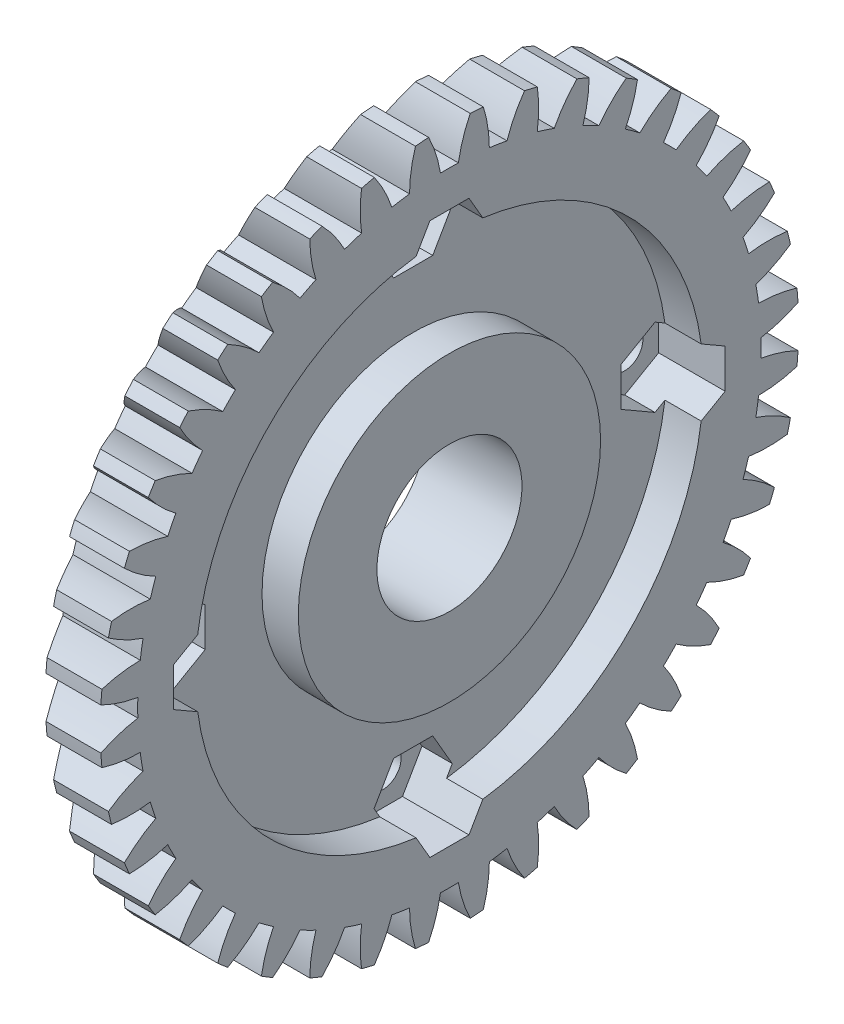
from build123d import *

# Parameters (mm, degrees)
BASPROSKE_W         = 8
BASPROSKE_H         = 28.875
TOOTHCUT_DEPTH      = 42.61167204
TEETHCUTS_COUNT     = 40
BORSKE_R            = 6
BORE_DEPTH          = 50.0000508
SKETCH_1_R          = 1.5
CUT_EXTRUDE_1_DEPTH = 42.540438945
CUT_EXTRUDE_2_DEPTH = 5.5
SKETCH_3_R          = 21
SKETCH_3_R_2        = 12.5
CUT_EXTRUDE_3_DEPTH = 3


with BuildPart() as part:
    # BasProSke → Base-Revolve (revolve)
    with BuildSketch(Plane(origin=(0, 0, 0), x_dir=(1, 0, 0), z_dir=(0, 1, 0)), mode=Mode.PRIVATE) as base_revolve_sk:
        with Locations((4, 14.4375)):
            Rectangle(BASPROSKE_W, BASPROSKE_H)
    revolve(base_revolve_sk.sketch.rotate(Axis((-10, 0, 0), (1, 0, 0)), 180), axis=Axis((-10, 0, 0), (1, 0, 0)))

    # TooCutSke → ToothCut (cut, through all)
    with BuildSketch(Plane(origin=(0, 0, 0), x_dir=(0, 0, -1), z_dir=(1, 0, 0))):
        with BuildLine():
            ThreePointArc((0.73985828, 25.769631348), (0, 25.78025), (-0.73985828, 25.769631348))
            ThreePointArc((-0.73985828, 25.769631348), (-1.12269264, 27.345722393), (-1.733123409, 28.848386496))
            ThreePointArc((-1.733123409, 28.848386496), (0, 28.9004), (1.733123409, 28.848386496))
            ThreePointArc((1.733123409, 28.848386496), (1.12269264, 27.345722393), (0.73985828, 25.769631348))
        make_face()
    toothcut = extrude(amount=TOOTHCUT_DEPTH, mode=Mode.SUBTRACT)

    # TeethCuts: ToothCut ×40 about axis
    teethcuts_axis = Axis((0, 0, 0), (1, 0, 0))
    for i in range(1, TEETHCUTS_COUNT):
        add(toothcut.rotate(teethcuts_axis, i * 360 / TEETHCUTS_COUNT), mode=Mode.SUBTRACT)

    # BorSke → Bore (cut, symmetric)
    with BuildSketch(Plane(origin=(0, 0, 0), x_dir=(0, 0, -1), z_dir=(1, 0, 0))):
        with Locations(Location((0, 0, 0), (0, 0, 180))):
            Circle(BORSKE_R)
    extrude(amount=BORE_DEPTH, both=True, mode=Mode.SUBTRACT)

    # 草图1 → 切除-拉伸1 (cut, through all)
    with BuildSketch(Plane(origin=(8, 0, 0), x_dir=(0, 0, -1), z_dir=(1, 0, 0))):
        with Locations((20, 0)):
            Circle(SKETCH_1_R)
        with Locations((0, -20)):
            Circle(SKETCH_1_R)
        with Locations((-20, 0)):
            Circle(SKETCH_1_R)
        with Locations((0, 20)):
            Circle(SKETCH_1_R)
    extrude(amount=-CUT_EXTRUDE_1_DEPTH, mode=Mode.SUBTRACT)

    # 草图2 → 切除-拉伸2 (cut)
    with BuildSketch(Plane(origin=(8, 0, 0), x_dir=(0, 0, -1), z_dir=(1, 0, 0))):
        Polygon((-1.616580754, 17.2), (1.616580754, 17.2), (3.233161507, 20), (1.616580754, 22.8), (-1.616580754, 22.8), (-3.233161507, 20), align=None)
        Polygon((17.2, 1.616580754), (17.2, -1.616580754), (20, -3.233161507), (22.8, -1.616580754), (22.8, 1.616580754), (20, 3.233161507), align=None)
        Polygon((1.616580754, -17.2), (-1.616580754, -17.2), (-3.233161507, -20), (-1.616580754, -22.8), (1.616580754, -22.8), (3.233161507, -20), align=None)
        Polygon((-17.2, -1.616580754), (-17.2, 1.616580754), (-20, 3.233161507), (-22.8, 1.616580754), (-22.8, -1.616580754), (-20, -3.233161507), align=None)
    extrude(amount=-CUT_EXTRUDE_2_DEPTH, mode=Mode.SUBTRACT)

    # 草图3 → 切除-拉伸3 (cut)
    with BuildSketch(Plane(origin=(8, 0, 0), x_dir=(0, 0, -1), z_dir=(1, 0, 0))):
        Circle(SKETCH_3_R)
        Circle(SKETCH_3_R_2, mode=Mode.SUBTRACT)
    extrude(amount=-CUT_EXTRUDE_3_DEPTH, mode=Mode.SUBTRACT)

    # 草图7 → 切除-旋转4 (revolve, cut)
    with BuildSketch(Plane(origin=(0, 0, 0), x_dir=(1, 0, 0), z_dir=(0, 1, 0)), mode=Mode.PRIVATE) as cut_revolve_4_sk:
        Polygon((0, -29.76877614), (0, -23.116378814), (4, -29.76877614), align=None)
    revolve(cut_revolve_4_sk.sketch.rotate(Axis((0, 0, 0), (-1, 0, 0)), 180), axis=Axis((0, 0, 0), (-1, 0, 0)), mode=Mode.SUBTRACT)


solid = part.part
